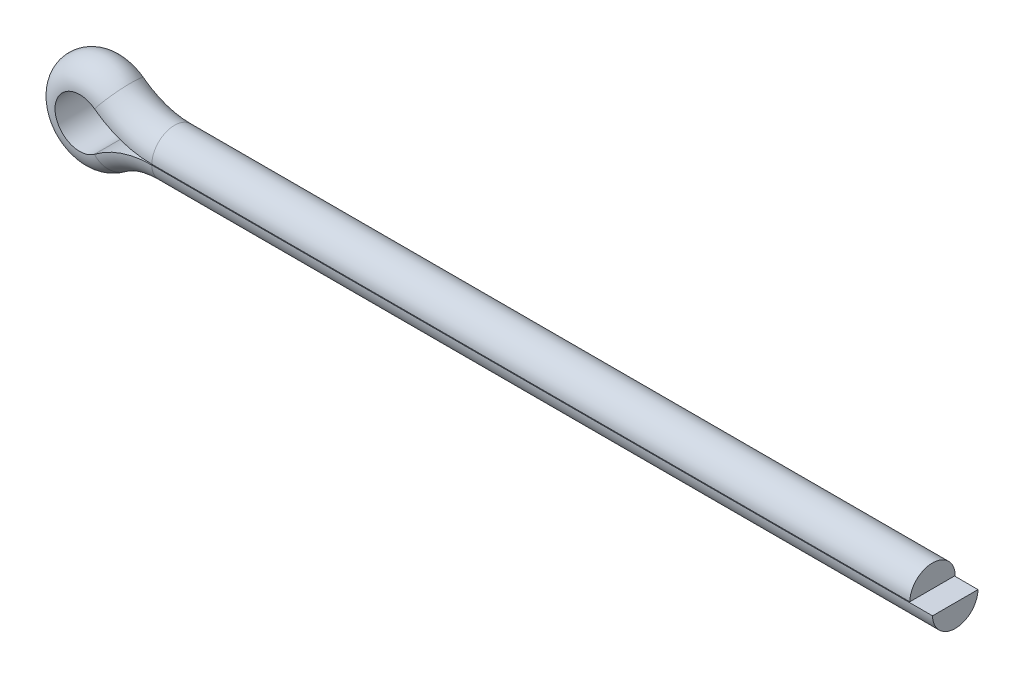
from build123d import *


with BuildPart() as part:
    # Sweep1: sweep along a path in Sketch3
    with BuildLine(Plane.XY) as sweep1_path:
        Line((0, 0.0254), (-50.8, 0.0254))
        ThreePointArc((-50.8, 0.0254), (-52.823920445, 0.356575694), (-54.636731203, 1.31555873))
        ThreePointArc((-54.636731203, 1.31555873), (-57.285281316, 0), (-54.636731203, -1.31555873))
        ThreePointArc((-54.636731203, -1.31555873), (-52.823920445, -0.356575694), (-50.8, -0.0254))
        Line((-50.8, -0.0254), (1.524, -0.0254))
    # Sketch4 → Sweep1 (sweep)
    with BuildSketch(Plane(origin=(0, 0, 0), x_dir=(0, 0, -1), z_dir=(1, 0, 0))):
        with BuildLine():
            Line((-1.523788319, 0.0254), (1.523788319, 0.0254))
            ThreePointArc((1.523788319, 0.0254), (0, 1.524), (-1.523788319, 0.0254))
        make_face()
    sweep(path=sweep1_path.line)


solid = part.part
